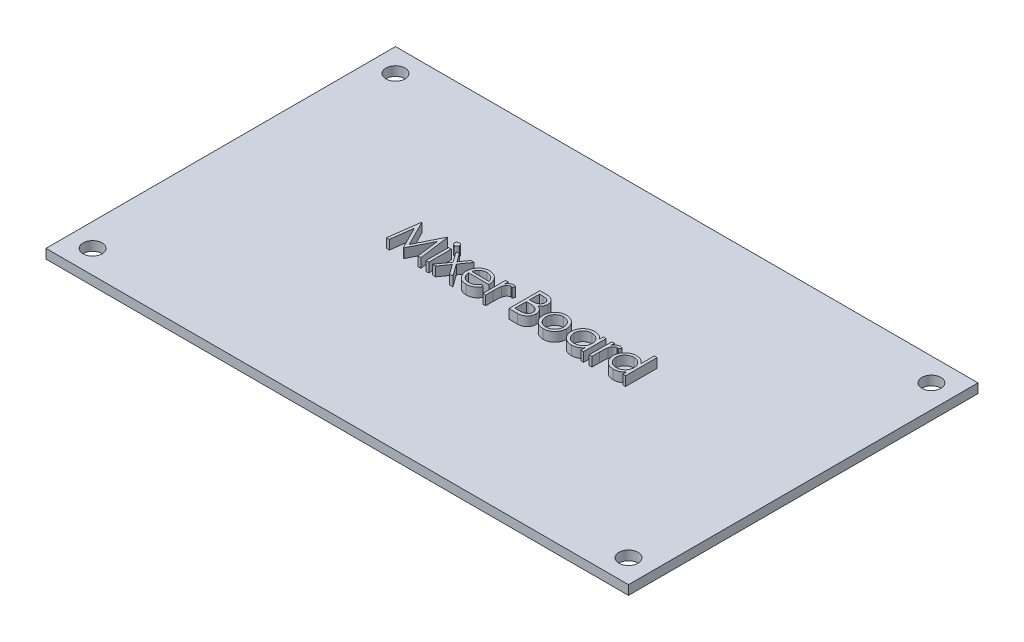
from build123d import *

# Parameters (mm, degrees)
SKETCH1_W             = 100
SKETCH1_H             = 60
BOSS_EXTRUDE1_DEPTH   = 1.6
F_4_CLEARANCE_HOLE1_D = 3.2639
SKETCH6_W             = 0.474893163
SKETCH6_H             = 3.86698718
BOSS_EXTRUDE2_DEPTH   = 1.6


with BuildPart() as part:
    # Sketch1 → Boss-Extrude1 (new body)
    with BuildSketch(Plane(origin=(0, 0, 0), x_dir=(1, 0, 0), z_dir=(0, 1, 0))):
        Rectangle(SKETCH1_W, SKETCH1_H)
    extrude(amount=BOSS_EXTRUDE1_DEPTH)

    # #4 Clearance Hole1 (through all)
    with Locations(Plane(origin=(0, 1.6, 0), x_dir=(1, 0, 0), z_dir=(0, 1, 0))):
        with Locations((-46, 26), (46, 26), (46, -26), (-46, -26)):
            Hole(F_4_CLEARANCE_HOLE1_D / 2)

    # Sketch6 → Boss-Extrude2 (add)
    # profile 1 of 11: a face of its own
    with BuildSketch(Plane(origin=(0, 1.6, 0), x_dir=(1, 0, 0), z_dir=(0, 1, 0))):
        Polygon((-20.754220467, -0.795536532), (-20.055661105, 4.496130135), (-19.987819225, 4.496130135), (-17.803098672, 0.154249793), (-15.623678266, 4.496130135), (-15.554776356, 4.496130135), (-14.851976877, -0.795536532), (-15.328990098, -0.795536532), (-15.835684142, 3.012089002), (-17.745857086, -0.795536532), (-17.852920053, -0.795536532), (-19.770513202, 3.020569237), (-20.276147216, -0.795536532), align=None)
    # profile 2 of 11: a face of its own
    with BuildSketch(Plane(origin=(0, 1.6, 0), x_dir=(1, 0, 0), z_dir=(0, 1, 0))):
        with BuildLine():
            add(Edge.make_bspline(
                [(-13.73470591, 4.699655776), (-13.705236897, 4.698288783), (-13.64753091, 4.69561195), (-13.564083945, 4.672689241), (-13.488100129, 4.633833764), (-13.420702843, 4.58170377), (-13.362869633, 4.520396873), (-13.32237975, 4.44894279), (-13.296356246, 4.371746991), (-13.293213668, 4.317900368), (-13.291613629, 4.290484435)],
                knots=[0, 0, 0, 0, 1.055194115, 2.066272739, 3.074728998, 4.095836921, 5.109056067, 6.073838105, 7.019297344, 8, 8, 8, 8], degree=3))
            add(Edge.make_bspline(
                [(-13.291613629, 4.290484435), (-13.293249752, 4.263780186), (-13.296484173, 4.210989045), (-13.322359649, 4.135131533), (-13.363214699, 4.064670295), (-13.420665758, 4.003482436), (-13.488109956, 3.95138126), (-13.564081335, 3.912518143), (-13.647531596, 3.889597459), (-13.705237129, 3.886920347), (-13.73470591, 3.885553212)],
                knots=[0, 0, 0, 0, 0.96129708, 1.900370562, 2.859976407, 3.87933698, 4.906634145, 5.921202961, 6.938410037, 8, 8, 8, 8], degree=3))
            add(Edge.make_bspline(
                [(-13.73470591, 3.885553212), (-13.763837707, 3.886868146), (-13.820538944, 3.889427493), (-13.902736432, 3.912967877), (-13.978072362, 3.951394559), (-14.045601094, 4.003141291), (-14.1018896, 4.065046077), (-14.142859687, 4.135088533), (-14.168675403, 4.210999993), (-14.171917877, 4.263783863), (-14.173558074, 4.290484435)],
                knots=[0, 0, 0, 0, 1.054934014, 2.053291228, 3.073705704, 4.106921865, 5.123545215, 6.088680038, 7.033164197, 8, 8, 8, 8], degree=3))
            add(Edge.make_bspline(
                [(-14.173558074, 4.290484435), (-14.171953812, 4.317896553), (-14.16880294, 4.371735682), (-14.142840336, 4.448986505), (-14.102230865, 4.520018062), (-14.045563822, 4.58204471), (-13.978082281, 4.633820546), (-13.902733869, 4.67223953), (-13.820539621, 4.695781912), (-13.763837937, 4.698340983), (-13.73470591, 4.699655776)],
                knots=[0, 0, 0, 0, 0.98631895, 1.937192651, 2.907499808, 3.917963147, 4.944918757, 5.95915025, 6.951458133, 8, 8, 8, 8], degree=3))
        make_face()
    # profile 3 of 11: a face of its own
    with BuildSketch(Plane(origin=(0, 1.6, 0), x_dir=(1, 0, 0), z_dir=(0, 1, 0))):
        with Locations((-13.732585852, 1.137957058)):
            Rectangle(SKETCH6_W, SKETCH6_H)
    # profile 4 of 11: a face of its own
    with BuildSketch(Plane(origin=(0, 1.6, 0), x_dir=(1, 0, 0), z_dir=(0, 1, 0))):
        Polygon((-12.681036706, 3.071450648), (-12.116041047, 3.071450648), (-11.120673458, 1.676451983), (-10.12530587, 3.071450648), (-9.560310211, 3.071450648), (-10.837645614, 1.281061024), (-9.35678457, -0.795536532), (-9.921780229, -0.795536532), (-11.120673458, 0.884610036), (-12.319566688, -0.795536532), (-12.884562347, -0.795536532), (-11.402641274, 1.281061024), align=None)
    # profile 5 of 11: a face of its own
    with BuildSketch(Plane(origin=(0, 1.6, 0), x_dir=(1, 0, 0), z_dir=(0, 1, 0))):
        with BuildLine():
            Line((-5.640321562, 0.425617314), (-5.218429869, 0.204071174))
            add(Edge.make_bspline(
                [(-5.218429869, 0.204071174), (-5.252049483, 0.144436613), (-5.317459939, 0.028411375), (-5.429946784, -0.130991557), (-5.54786337, -0.274392271), (-5.676532464, -0.397959724), (-5.812104479, -0.505685032), (-5.955331231, -0.599933886), (-6.106958372, -0.68024403), (-6.266993075, -0.74790559), (-6.436779301, -0.799929468), (-6.616728498, -0.836675136), (-6.807185402, -0.859388887), (-6.937732602, -0.862027374), (-7.004579375, -0.863378412)],
                knots=[0, 0, 0, 0, 1.120438281, 2.179929193, 3.190490725, 4.156257408, 5.095198341, 6.022838206, 6.959905092, 7.901321166, 8.864066838, 9.862729781, 10.905609505, 12, 12, 12, 12], degree=3))
            add(Edge.make_bspline(
                [(-7.004579375, -0.863378412), (-7.078877364, -0.861643992), (-7.223811218, -0.858260642), (-7.434782026, -0.829092273), (-7.633415195, -0.781509064), (-7.819699556, -0.715037352), (-7.993178914, -0.628212708), (-8.154198063, -0.522440634), (-8.303603775, -0.398264487), (-8.436687996, -0.254608674), (-8.5564972, -0.100875238), (-8.66221838, 0.059319968), (-8.750600448, 0.225573891), (-8.822495466, 0.396828136), (-8.880559964, 0.572003308), (-8.921028671, 0.752693265), (-8.944356981, 0.93840897), (-8.947931797, 1.064044227), (-8.949733287, 1.127356764)],
                knots=[0, 0, 0, 0, 1.145258523, 2.234067595, 3.276747158, 4.290159414, 5.277019952, 6.260822364, 7.254936242, 8.264827045, 9.274100331, 10.257902744, 11.220704747, 12.172965371, 13.118907548, 14.062713208, 15.023725156, 16, 16, 16, 16], degree=3))
            add(Edge.make_bspline(
                [(-8.949733287, 1.127356764), (-8.948131967, 1.186766805), (-8.94495836, 1.304509661), (-8.92495467, 1.478780187), (-8.889503084, 1.648156538), (-8.840855546, 1.812779453), (-8.778034019, 1.972373299), (-8.701180545, 2.127035204), (-8.610175403, 2.276600594), (-8.539913146, 2.370948189), (-8.504520948, 2.418472549)],
                knots=[0, 0, 0, 0, 1.024358464, 2.0301432, 3.019427413, 4.004406732, 4.986367066, 5.972626655, 6.978780325, 8, 8, 8, 8], degree=3))
            add(Edge.make_bspline(
                [(-8.504520948, 2.418472549), (-8.456581951, 2.475726674), (-8.362222544, 2.588421259), (-8.202631387, 2.73649468), (-8.029820376, 2.860537054), (-7.84595518, 2.963357367), (-7.648898844, 3.041483), (-7.441300273, 3.099702797), (-7.220795637, 3.132326695), (-7.070050839, 3.136934729), (-6.992919051, 3.139292528)],
                knots=[0, 0, 0, 0, 1.030682036, 2.02871468, 2.997146059, 3.962720338, 4.930598197, 5.918074684, 6.934738563, 8, 8, 8, 8], degree=3))
            add(Edge.make_bspline(
                [(-6.992919051, 3.139292528), (-6.913623267, 3.137245335), (-6.758063014, 3.133229209), (-6.531228736, 3.095996538), (-6.316597653, 3.036952795), (-6.114255652, 2.953565517), (-5.92418222, 2.845979051), (-5.747612835, 2.712716981), (-5.581527811, 2.557870588), (-5.484904126, 2.438788116), (-5.435735892, 2.378191433)],
                knots=[0, 0, 0, 0, 1.056321875, 2.072262726, 3.055038591, 4.01806755, 4.982017516, 5.957941055, 6.960871419, 8, 8, 8, 8], degree=3))
            add(Edge.make_bspline(
                [(-5.435735892, 2.378191433), (-5.402282068, 2.332526494), (-5.3355971, 2.241500577), (-5.252068746, 2.093075137), (-5.179561733, 1.9377865), (-5.121605946, 1.773124503), (-5.074677177, 1.601040138), (-5.040724606, 1.420303196), (-5.020813396, 1.230967496), (-5.016899533, 1.101961871), (-5.014904228, 1.036194237)],
                knots=[0, 0, 0, 0, 0.94817472, 1.890038105, 2.849395472, 3.817997239, 4.812318967, 5.836947057, 6.897266129, 8, 8, 8, 8], degree=3))
            Line((-5.014904228, 1.036194237), (-8.474840125, 1.036194237))
            add(Edge.make_bspline(
                [(-8.474840125, 1.036194237), (-8.472512387, 0.985242345), (-8.467934983, 0.885047504), (-8.446594231, 0.738436915), (-8.412956204, 0.598777219), (-8.365680359, 0.467115953), (-8.308429296, 0.341733498), (-8.23829851, 0.223559943), (-8.154630375, 0.113133548), (-8.061306996, 0.009466566), (-7.957428411, -0.082851489), (-7.848143781, -0.16547977), (-7.731888034, -0.23473347), (-7.609577837, -0.290945922), (-7.481410971, -0.3349519), (-7.347347057, -0.364990153), (-7.207649905, -0.385109231), (-7.112421474, -0.387346344), (-7.06394102, -0.38848525)],
                knots=[0, 0, 0, 0, 1.094153842, 2.151609401, 3.174256925, 4.172055639, 5.149267565, 6.128595816, 7.11444997, 8.118368179, 9.117203808, 10.09244225, 11.054858984, 12.015122123, 12.976791628, 13.957293641, 14.960065497, 16, 16, 16, 16], degree=3))
            add(Edge.make_bspline(
                [(-7.06394102, -0.38848525), (-7.016541071, -0.387565926), (-6.922490478, -0.385741811), (-6.782426325, -0.368004279), (-6.644632039, -0.339323029), (-6.509677934, -0.30017983), (-6.380302964, -0.252438637), (-6.26049124, -0.194830745), (-6.150303295, -0.131104342), (-6.047316929, -0.058215905), (-5.947423879, 0.030998854), (-5.848329882, 0.142329051), (-5.742078275, 0.273997099), (-5.6755702, 0.373095904), (-5.640321562, 0.425617314)],
                knots=[0, 0, 0, 0, 0.99110716, 1.966546729, 2.947904876, 3.932708344, 4.903319531, 5.828989031, 6.710028674, 7.56322171, 8.463672341, 9.504779593, 10.677557249, 12, 12, 12, 12], degree=3))
        make_face()
        with BuildLine():
            add(Edge.make_bspline(
                [(-5.48979739, 1.5110874), (-5.507179191, 1.574077697), (-5.540633564, 1.695313742), (-5.610538544, 1.863196993), (-5.689265754, 2.012403701), (-5.782431943, 2.141791956), (-5.887991207, 2.256702029), (-6.009919042, 2.357120604), (-6.1466495, 2.446954131), (-6.29747582, 2.522779934), (-6.457196138, 2.587322935), (-6.624422166, 2.630601383), (-6.795052393, 2.660249144), (-6.910462564, 2.663010046), (-6.968538376, 2.664399366)],
                knots=[0, 0, 0, 0, 1.154881502, 2.222775134, 3.210006277, 4.132804581, 5.035138423, 5.962687519, 6.919655026, 7.923214229, 8.944639381, 9.960483929, 10.97369054, 12, 12, 12, 12], degree=3))
            add(Edge.make_bspline(
                [(-6.968538376, 2.664399366), (-7.015935741, 2.663474576), (-7.109630368, 2.661646463), (-7.247668887, 2.64430472), (-7.380232242, 2.61563924), (-7.508298569, 2.576382698), (-7.630189644, 2.524057787), (-7.748412687, 2.462699814), (-7.859961619, 2.387797657), (-7.929722863, 2.330709865), (-7.964965993, 2.301869317)],
                knots=[0, 0, 0, 0, 1.04873581, 2.073130211, 3.073294108, 4.04793562, 5.032784715, 6.005352987, 6.992311501, 8, 8, 8, 8], degree=3))
            add(Edge.make_bspline(
                [(-7.964965993, 2.301869317), (-7.990204646, 2.27904815), (-8.041281527, 2.232863668), (-8.109529697, 2.15329332), (-8.174874935, 2.067490363), (-8.234343672, 1.972172139), (-8.288889547, 1.868424057), (-8.339931417, 1.757121203), (-8.385872778, 1.637418971), (-8.411720468, 1.554003497), (-8.425018744, 1.5110874)],
                knots=[0, 0, 0, 0, 0.879870761, 1.780643979, 2.707998968, 3.669668524, 4.684282772, 5.740141944, 6.837334558, 8, 8, 8, 8], degree=3))
            Line((-8.425018744, 1.5110874), (-5.48979739, 1.5110874))
        make_face(mode=Mode.SUBTRACT)
    # profile 6 of 11: a face of its own
    with BuildSketch(Plane(origin=(0, 1.6, 0), x_dir=(1, 0, 0), z_dir=(0, 1, 0))):
        with BuildLine():
            Line((-4.200801664, 3.071450648), (-3.725908501, 3.071450648))
            Line((-3.725908501, 3.071450648), (-3.725908501, 2.50221487))
            add(Edge.make_bspline(
                [(-3.725908501, 2.50221487), (-3.690849306, 2.555215944), (-3.623798869, 2.656580086), (-3.51235194, 2.790639624), (-3.398198094, 2.901636183), (-3.280790846, 2.990087931), (-3.159266814, 3.056329194), (-3.03629309, 3.104850807), (-2.909934939, 3.1335427), (-2.825023458, 3.137373351), (-2.782482353, 3.139292528)],
                knots=[0, 0, 0, 0, 1.2804753, 2.448899062, 3.506932113, 4.484331642, 5.4025378, 6.288909075, 7.142734305, 8, 8, 8, 8], degree=3))
            add(Edge.make_bspline(
                [(-2.782482353, 3.139292528), (-2.749483026, 3.137492565), (-2.681584766, 3.133789025), (-2.578801565, 3.107767897), (-2.472902536, 3.066223744), (-2.404651546, 3.027155788), (-2.369070894, 3.006788855)],
                knots=[0, 0, 0, 0, 0.901110191, 1.854092781, 2.881294221, 4, 4, 4, 4], degree=3))
            Line((-2.369070894, 3.006788855), (-2.629838122, 2.595497456))
            add(Edge.make_bspline(
                [(-2.629838122, 2.595497456), (-2.652681523, 2.605688096), (-2.696042671, 2.625031883), (-2.75947398, 2.64792516), (-2.817956477, 2.661405175), (-2.85521519, 2.663447332), (-2.87258485, 2.664399366)],
                knots=[0, 0, 0, 0, 1.180555205, 2.24091978, 3.179933427, 4, 4, 4, 4], degree=3))
            add(Edge.make_bspline(
                [(-2.87258485, 2.664399366), (-2.910693519, 2.661859309), (-2.988424156, 2.65667833), (-3.10254953, 2.615949418), (-3.213292329, 2.550143401), (-3.301242342, 2.477162077), (-3.369341939, 2.40678624), (-3.417934899, 2.345329727), (-3.462510004, 2.276419177), (-3.505100694, 2.201232631), (-3.543905687, 2.118486316), (-3.580122865, 2.029006934), (-3.612869003, 1.932690846), (-3.631541396, 1.865588703), (-3.641106151, 1.831216273)],
                knots=[0, 0, 0, 0, 1.125678352, 2.296057538, 3.5422874, 4.923748041, 5.663163013, 6.437101912, 7.23742474, 8.08941207, 8.991984279, 9.93940061, 10.944477711, 12, 12, 12, 12], degree=3))
            add(Edge.make_bspline(
                [(-3.641106151, 1.831216273), (-3.648261079, 1.800559117), (-3.664108701, 1.732655848), (-3.679517335, 1.618736055), (-3.694741488, 1.484140761), (-3.705470899, 1.328495317), (-3.715416272, 1.152188408), (-3.721025563, 0.954951442), (-3.725717216, 0.736581971), (-3.725842805, 0.583918365), (-3.725908501, 0.504059488)],
                knots=[0, 0, 0, 0, 0.566838948, 1.255505196, 2.06880316, 3.007127437, 4.065329342, 5.249902469, 6.561414163, 8, 8, 8, 8], degree=3))
            Line((-3.725908501, 0.504059488), (-3.725908501, -0.795536532))
            Line((-3.725908501, -0.795536532), (-4.200801664, -0.795536532))
            Line((-4.200801664, -0.795536532), (-4.200801664, 3.071450648))
        make_face()
    # profile 7 of 11: a face of its own
    with BuildSketch(Plane(origin=(0, 1.6, 0), x_dir=(1, 0, 0), z_dir=(0, 1, 0))):
        with BuildLine():
            Line((0.276762439, 4.496130135), (1.309231055, 4.496130135))
            add(Edge.make_bspline(
                [(1.309231055, 4.496130135), (1.359771731, 4.495864417), (1.457732138, 4.49534939), (1.600182961, 4.487361798), (1.733606758, 4.476470536), (1.858042223, 4.459189324), (1.973431857, 4.438337471), (2.080123403, 4.413085915), (2.177777592, 4.382807583), (2.294364706, 4.334659038), (2.427292372, 4.263110915), (2.571223275, 4.157385584), (2.694298732, 4.028068646), (2.800413759, 3.88219606), (2.884779738, 3.721728881), (2.945814271, 3.550491774), (2.984455344, 3.370693426), (2.988429286, 3.247256717), (2.990437653, 3.184873791)],
                knots=[0, 0, 0, 0, 1.001505555, 1.941167018, 2.826882275, 3.653841531, 4.429895133, 5.150066043, 5.825578002, 6.45369114, 7.647487171, 8.808567382, 9.977351308, 11.170798116, 12.373658725, 13.556498008, 14.765093433, 16, 16, 16, 16], degree=3))
            add(Edge.make_bspline(
                [(2.990437653, 3.184873791), (2.988784811, 3.126434808), (2.98553682, 3.011596696), (2.954478124, 2.843632983), (2.905854256, 2.683747211), (2.838264177, 2.532522891), (2.750419493, 2.393376833), (2.646312273, 2.265186561), (2.520708059, 2.153379606), (2.426602208, 2.090873075), (2.3788007, 2.059122589)],
                knots=[0, 0, 0, 0, 1.044552857, 2.05264487, 3.044412934, 4.028983338, 5.005914585, 5.980388656, 6.974128949, 8, 8, 8, 8], degree=3))
            add(Edge.make_bspline(
                [(2.3788007, 2.059122589), (2.43891468, 2.036043365), (2.553927615, 1.991887091), (2.712202895, 1.913819187), (2.848568911, 1.828907425), (2.96407412, 1.736179509), (3.062858432, 1.636229283), (3.149117046, 1.527591193), (3.222718647, 1.408848071), (3.285784615, 1.281237964), (3.334995234, 1.146063899), (3.37184928, 1.004593797), (3.392966733, 0.857334946), (3.395971857, 0.757117765), (3.397488935, 0.7065251)],
                knots=[0, 0, 0, 0, 1.27268992, 2.434971085, 3.483601985, 4.442670788, 5.356604649, 6.2567628, 7.179492994, 8.113709626, 9.066344395, 10.018646069, 10.999752585, 12, 12, 12, 12], degree=3))
            add(Edge.make_bspline(
                [(3.397488935, 0.7065251), (3.396012037, 0.654868043), (3.393106198, 0.553231337), (3.371667431, 0.403922979), (3.335367948, 0.261237048), (3.285367524, 0.124250641), (3.220110215, -0.006771229), (3.140692936, -0.131976998), (3.045999977, -0.250108664), (2.940071591, -0.362478904), (2.820234776, -0.463516154), (2.690943099, -0.553498234), (2.550568306, -0.627500018), (2.401415886, -0.689663527), (2.241812694, -0.73714822), (2.072475419, -0.770368659), (1.893550105, -0.792752465), (1.770768696, -0.794592763), (1.707802102, -0.795536532)],
                knots=[0, 0, 0, 0, 0.978564426, 1.925352924, 2.850884081, 3.763762016, 4.682927383, 5.618979971, 6.567305752, 7.547517671, 8.540179244, 9.531824382, 10.526200242, 11.540722885, 12.589160233, 13.674978461, 14.80764778, 16, 16, 16, 16], degree=3))
            Line((1.707802102, -0.795536532), (0.276762439, -0.795536532))
            Line((0.276762439, -0.795536532), (0.276762439, 4.496130135))
        make_face()
        with BuildLine():
            Line((0.751655601, 3.953395092), (0.751655601, 2.257348083))
            Line((0.751655601, 2.257348083), (1.070724445, 2.257348083))
            add(Edge.make_bspline(
                [(1.070724445, 2.257348083), (1.117364885, 2.257952729), (1.207483722, 2.259121027), (1.337991184, 2.262467654), (1.459132581, 2.271838506), (1.570698805, 2.281206664), (1.672514166, 2.296438481), (1.7643531, 2.314569429), (1.847656931, 2.333744773), (1.943722672, 2.366355783), (2.052690106, 2.414551792), (2.168854442, 2.489348497), (2.271262509, 2.578436507), (2.35773921, 2.681232366), (2.428513695, 2.794422909), (2.477671336, 2.916202121), (2.51100473, 3.043534939), (2.514015736, 3.130950631), (2.51554449, 3.175333527)],
                knots=[0, 0, 0, 0, 1.156816544, 2.235205308, 3.236616184, 4.169592532, 5.011045266, 5.787822928, 6.49130361, 7.128639758, 8.301311294, 9.436451833, 10.541879658, 11.654887649, 12.756523258, 13.837046038, 14.901820046, 16, 16, 16, 16], degree=3))
            add(Edge.make_bspline(
                [(2.51554449, 3.175333527), (2.514748956, 3.204703443), (2.513188429, 3.262315742), (2.50040784, 3.346301075), (2.478685436, 3.425288653), (2.450784302, 3.500360939), (2.411794261, 3.569170522), (2.365887596, 3.634096544), (2.310422326, 3.692927961), (2.247289246, 3.747915179), (2.174704781, 3.796665834), (2.092712232, 3.839363178), (2.000202292, 3.873745067), (1.898734047, 3.903856393), (1.786745617, 3.925005361), (1.665529328, 3.942624173), (1.534092312, 3.951593914), (1.443158646, 3.952781308), (1.396153465, 3.953395092)],
                knots=[0, 0, 0, 0, 0.91205012, 1.789085906, 2.630437955, 3.453916878, 4.269457761, 5.079663411, 5.91843418, 6.774407191, 7.675494373, 8.627863946, 9.638891023, 10.736472738, 11.911756761, 13.175263542, 14.539845004, 16, 16, 16, 16], degree=3))
            Line((1.396153465, 3.953395092), (0.751655601, 3.953395092))
        make_face(mode=Mode.SUBTRACT)
        with BuildLine():
            Line((0.751655601, 1.714613041), (0.751655601, -0.252801489))
            Line((0.751655601, -0.252801489), (1.427954346, -0.252801489))
            add(Edge.make_bspline(
                [(1.427954346, -0.252801489), (1.476363913, -0.2522213), (1.56966697, -0.251103061), (1.704379544, -0.247452484), (1.829237332, -0.239148687), (1.943670585, -0.226076985), (2.04891496, -0.211897663), (2.143707916, -0.192830608), (2.228817863, -0.170985155), (2.3275064, -0.137218014), (2.438636704, -0.084760254), (2.558395975, -0.005666126), (2.664873709, 0.088560779), (2.755293566, 0.197615852), (2.829396536, 0.316196549), (2.883304189, 0.441904399), (2.91655227, 0.57266228), (2.920577216, 0.661814333), (2.922595772, 0.7065251)],
                knots=[0, 0, 0, 0, 1.160039823, 2.235823828, 3.228722157, 4.157150951, 4.99529583, 5.772374946, 6.472645482, 7.099169577, 8.269452708, 9.405989375, 10.527446681, 11.663510218, 12.788923519, 13.866172445, 14.929861265, 16, 16, 16, 16], degree=3))
            add(Edge.make_bspline(
                [(2.922595772, 0.7065251), (2.922178329, 0.73448527), (2.921350175, 0.789954609), (2.908860912, 0.871470193), (2.890697085, 0.950430739), (2.867215037, 1.027050656), (2.833016557, 1.09994469), (2.793092375, 1.170554512), (2.746281685, 1.238973463), (2.673341101, 1.325472941), (2.567247743, 1.425133187), (2.416500595, 1.522707744), (2.245092477, 1.601399071), (2.120772339, 1.634811375), (2.056551769, 1.652071307)],
                knots=[0, 0, 0, 0, 0.723448775, 1.435228256, 2.130040452, 2.821711965, 3.505591119, 4.210454504, 4.921174351, 5.648778258, 7.137944449, 8.670945889, 10.280296675, 12, 12, 12, 12], degree=3))
            add(Edge.make_bspline(
                [(2.056551769, 1.652071307), (2.030805397, 1.657295065), (1.974981954, 1.66862125), (1.883953827, 1.680576944), (1.780031739, 1.691228404), (1.662975722, 1.699107178), (1.532637677, 1.707251119), (1.38873924, 1.710418289), (1.231868062, 1.714196932), (1.123022452, 1.71447079), (1.066484327, 1.714613041)],
                knots=[0, 0, 0, 0, 0.634451884, 1.375622551, 2.216452059, 3.157844607, 4.20941857, 5.370758133, 6.634282058, 8, 8, 8, 8], degree=3))
            Line((1.066484327, 1.714613041), (0.751655601, 1.714613041))
        make_face(mode=Mode.SUBTRACT)
    # profile 8 of 11: a face of its own
    with BuildSketch(Plane(origin=(0, 1.6, 0), x_dir=(1, 0, 0), z_dir=(0, 1, 0))):
        with BuildLine():
            add(Edge.make_bspline(
                [(6.215047028, 3.139292528), (6.287605262, 3.137747526), (6.429874226, 3.134718154), (6.638226625, 3.102340766), (6.837110342, 3.05282987), (7.027287085, 2.984383579), (7.206321246, 2.892638249), (7.376820627, 2.783162297), (7.538317772, 2.653467186), (7.635114494, 2.553140106), (7.684247749, 2.50221487)],
                knots=[0, 0, 0, 0, 1.054011418, 2.066658804, 3.057071809, 4.030435133, 4.997543892, 5.974964718, 6.972108034, 8, 8, 8, 8], degree=3))
            add(Edge.make_bspline(
                [(7.684247749, 2.50221487), (7.726553798, 2.453510392), (7.810347159, 2.357044001), (7.917791758, 2.200628967), (8.010352926, 2.038643338), (8.08453145, 1.868936071), (8.143019522, 1.692988651), (8.184545039, 1.510196325), (8.209244929, 1.320962776), (8.212575605, 1.192445069), (8.214262439, 1.127356764)],
                knots=[0, 0, 0, 0, 1.025258237, 2.030674902, 3.01204498, 3.988269485, 4.97094183, 5.956517959, 6.965070386, 8, 8, 8, 8], degree=3))
            add(Edge.make_bspline(
                [(8.214262439, 1.127356764), (8.21277875, 1.061891201), (8.209846913, 0.932528194), (8.182113112, 0.741998915), (8.138976827, 0.557251981), (8.077242976, 0.37906086), (7.998082502, 0.206880871), (7.901485867, 0.041464053), (7.786775208, -0.117515958), (7.656745356, -0.268709214), (7.513035971, -0.408055753), (7.357134176, -0.529504446), (7.192103672, -0.633556036), (7.015750031, -0.717370617), (6.829683712, -0.783455521), (6.633503382, -0.829871022), (6.427513812, -0.85793452), (6.286865513, -0.861538256), (6.215047028, -0.863378412)],
                knots=[0, 0, 0, 0, 0.998656419, 1.973391657, 2.932242238, 3.890759089, 4.846373663, 5.82037756, 6.809684879, 7.83454468, 8.860553229, 9.859544525, 10.845671541, 11.83227036, 12.833544569, 13.85385346, 14.904124723, 16, 16, 16, 16], degree=3))
            add(Edge.make_bspline(
                [(6.215047028, -0.863378412), (6.142876678, -0.86153208), (6.001527402, -0.857915945), (5.794810739, -0.829980053), (5.598278815, -0.783476913), (5.41196891, -0.717153441), (5.234857058, -0.633553357), (5.068870331, -0.529819017), (4.912841887, -0.408019735), (4.769102101, -0.268718973), (4.6390804, -0.117513444), (4.524367637, 0.0414634), (4.427771549, 0.206881041), (4.348610931, 0.379060815), (4.286877119, 0.557251993), (4.243740824, 0.741998912), (4.216007026, 0.932528195), (4.213075188, 1.061891201), (4.211591499, 1.127356764)],
                knots=[0, 0, 0, 0, 1.099876186, 2.154163076, 3.173186993, 4.173200201, 5.163417411, 6.152872554, 7.150605724, 8.17532212, 9.198891216, 10.186952605, 11.159729845, 12.11414092, 13.071450619, 14.029093627, 15.002601286, 16, 16, 16, 16], degree=3))
            add(Edge.make_bspline(
                [(4.211591499, 1.127356764), (4.213289837, 1.192091304), (4.216652255, 1.320254567), (4.24132731, 1.509132385), (4.282690842, 1.691615342), (4.341249025, 1.866883621), (4.416111278, 2.035847197), (4.507371797, 2.198233072), (4.615912396, 2.353940818), (4.699372489, 2.450282535), (4.741606189, 2.499034782)],
                knots=[0, 0, 0, 0, 1.031353054, 2.041901799, 3.029428768, 4.008703097, 4.981709435, 5.96992636, 6.972712378, 8, 8, 8, 8], degree=3))
            add(Edge.make_bspline(
                [(4.741606189, 2.499034782), (4.790665368, 2.550401655), (4.887148877, 2.651423648), (5.049449929, 2.780740678), (5.219529873, 2.892494742), (5.400542559, 2.982417116), (5.590563071, 3.053232494), (5.790465973, 3.102468451), (5.999525383, 3.1346015), (6.142490525, 3.137713268), (6.215047028, 3.139292528)],
                knots=[0, 0, 0, 0, 1.027980169, 2.021703884, 2.998553061, 3.971491411, 4.943284454, 5.930300938, 6.949603206, 8, 8, 8, 8], degree=3))
        make_face()
        with BuildLine():
            add(Edge.make_bspline(
                [(6.212926969, 2.664399366), (6.161616533, 2.662940995), (6.060320231, 2.660061901), (5.911216811, 2.638163616), (5.767676341, 2.603469176), (5.629426493, 2.554174948), (5.496933482, 2.490525422), (5.370070457, 2.412347306), (5.248464268, 2.32067605), (5.134493768, 2.215655106), (5.0298967, 2.100933293), (4.93845976, 1.978698274), (4.860709896, 1.850932727), (4.795939656, 1.717503789), (4.747699027, 1.577059306), (4.712663623, 1.43118978), (4.690785998, 1.27959802), (4.687933973, 1.176545051), (4.686484661, 1.124176676)],
                knots=[0, 0, 0, 0, 1.021534396, 2.016698045, 2.994645724, 3.958388632, 4.93408049, 5.916473867, 6.921342795, 7.962252576, 8.998418191, 10.008913653, 10.997312074, 11.973003931, 12.956656626, 13.948281152, 14.957379055, 16, 16, 16, 16], degree=3))
            add(Edge.make_bspline(
                [(4.686484661, 1.124176676), (4.688914026, 1.056515873), (4.693735859, 0.922221831), (4.732947467, 0.724447872), (4.79854339, 0.534580072), (4.887121777, 0.353731488), (4.998104989, 0.186405544), (5.128865197, 0.037223657), (5.277999029, -0.091569177), (5.443728738, -0.198431884), (5.622669195, -0.283340086), (5.812044823, -0.343512347), (6.009561111, -0.382627882), (6.144545073, -0.386515706), (6.212926969, -0.38848525)],
                knots=[0, 0, 0, 0, 1.016792936, 2.018143844, 3.017858371, 4.030088057, 5.03801393, 6.028138512, 7.003788237, 7.991172063, 8.984598303, 9.972568034, 10.972917682, 12, 12, 12, 12], degree=3))
            add(Edge.make_bspline(
                [(6.212926969, -0.38848525), (6.281304931, -0.386504231), (6.41628113, -0.382593754), (6.613522981, -0.343709348), (6.80238101, -0.283076433), (6.981135608, -0.198527377), (7.146789877, -0.091163369), (7.296996287, 0.036496391), (7.42664002, 0.186800666), (7.537513447, 0.353953121), (7.62754245, 0.534299701), (7.692831339, 0.724482915), (7.732137213, 0.922212907), (7.736946323, 1.056512883), (7.739369277, 1.124176676)],
                knots=[0, 0, 0, 0, 1.02726834, 2.027799167, 3.010890988, 4.004497153, 4.992059811, 5.971914811, 6.958719428, 7.966827853, 8.981595046, 9.981490638, 10.983022906, 12, 12, 12, 12], degree=3))
            add(Edge.make_bspline(
                [(7.739369277, 1.124176676), (7.737920464, 1.176545364), (7.735069421, 1.279598948), (7.713184653, 1.431186229), (7.678175683, 1.577072334), (7.629837642, 1.71745572), (7.565348835, 1.851278197), (7.486099636, 1.978323141), (7.395036062, 2.101356728), (7.289176844, 2.215284257), (7.175325308, 2.320716991), (7.053669834, 2.412382853), (6.926994926, 2.490181837), (6.79488683, 2.554719367), (6.656619258, 2.603020703), (6.513279908, 2.638363944), (6.36481266, 2.65996936), (6.263879344, 2.662913253), (6.212926969, 2.664399366)],
                knots=[0, 0, 0, 0, 1.042956736, 2.052379634, 3.044323526, 4.02829302, 5.004299113, 5.996692471, 7.007513377, 8.048758398, 9.090003419, 10.095195979, 11.07790575, 12.047570684, 13.018257071, 13.989683339, 14.985167495, 16, 16, 16, 16], degree=3))
        make_face(mode=Mode.SUBTRACT)
    # profile 9 of 11: a face of its own
    with BuildSketch(Plane(origin=(0, 1.6, 0), x_dir=(1, 0, 0), z_dir=(0, 1, 0))):
        with BuildLine():
            Line((13.098877824, 3.071450648), (13.098877824, -0.795536532))
            Line((13.098877824, -0.795536532), (12.623984661, -0.795536532))
            Line((12.623984661, -0.795536532), (12.623984661, -0.126657993))
            add(Edge.make_bspline(
                [(12.623984661, -0.126657993), (12.570434823, -0.187194046), (12.46593164, -0.305330914), (12.291395664, -0.459669437), (12.106386634, -0.587241423), (11.911802493, -0.690277605), (11.707818959, -0.767675119), (11.494888208, -0.822687526), (11.272923382, -0.858056777), (11.121351369, -0.861588619), (11.044540885, -0.863378412)],
                knots=[0, 0, 0, 0, 1.074387032, 2.096679803, 3.090159297, 4.057316773, 5.018401886, 5.985159533, 6.978961417, 8, 8, 8, 8], degree=3))
            add(Edge.make_bspline(
                [(11.044540885, -0.863378412), (10.97625124, -0.861524254), (10.841581037, -0.857867772), (10.643477552, -0.829500956), (10.452838079, -0.783946326), (10.269482475, -0.720596171), (10.094597208, -0.636563263), (9.926684919, -0.535959233), (9.766615492, -0.416154644), (9.61682876, -0.279194173), (9.478894664, -0.130430323), (9.357849645, 0.028237349), (9.256925346, 0.196122737), (9.1725307, 0.371100243), (9.107524322, 0.554516848), (9.062207042, 0.74573828), (9.033873271, 0.944538446), (9.030218301, 1.079913678), (9.028365003, 1.148557352)],
                knots=[0, 0, 0, 0, 1.033919861, 2.038935746, 3.024066025, 3.998881131, 4.97069526, 5.957263378, 6.95902576, 7.993208707, 9.027059324, 10.027763471, 11.009749337, 11.988697705, 12.965288445, 13.950418724, 14.960734635, 16, 16, 16, 16], degree=3))
            add(Edge.make_bspline(
                [(9.028365003, 1.148557352), (9.030259377, 1.215782237), (9.034004451, 1.348682208), (9.061903961, 1.544139287), (9.108819891, 1.732399039), (9.174660089, 1.91285537), (9.259087807, 2.085726636), (9.361788605, 2.251135102), (9.482769901, 2.409536453), (9.622246754, 2.557206046), (9.773338609, 2.693611022), (9.934974429, 2.812158032), (10.103133437, 2.914539458), (10.280423941, 2.995658404), (10.464221826, 3.061288836), (10.656163345, 3.106695823), (10.855449899, 3.133452488), (10.990751, 3.137327143), (11.059381296, 3.139292528)],
                knots=[0, 0, 0, 0, 1.020392517, 2.01726096, 2.990465484, 3.961182959, 4.928053699, 5.906110375, 6.912531644, 7.948652711, 8.985773172, 9.998621852, 10.987621588, 11.969261332, 12.953316658, 13.946091881, 14.958173133, 16, 16, 16, 16], degree=3))
            add(Edge.make_bspline(
                [(11.059381296, 3.139292528), (11.138302511, 3.137118785), (11.29306329, 3.132856176), (11.51943778, 3.097382767), (11.733590741, 3.03745318), (11.937175297, 2.955935058), (12.129460382, 2.847609003), (12.308625608, 2.71096311), (12.476546041, 2.546859172), (12.573882911, 2.420811), (12.623984661, 2.355930816)],
                knots=[0, 0, 0, 0, 1.038897134, 2.037228247, 3.008116434, 3.962042015, 4.918381754, 5.904844433, 6.921570401, 8, 8, 8, 8], degree=3))
            Line((12.623984661, 2.355930816), (12.623984661, 3.071450648))
            Line((12.623984661, 3.071450648), (13.098877824, 3.071450648))
        make_face()
        with BuildLine():
            add(Edge.make_bspline(
                [(11.065741472, 2.664399366), (10.996323366, 2.661929461), (10.859303066, 2.657054262), (10.658153206, 2.618994335), (10.465667449, 2.555668817), (10.282808503, 2.469064038), (10.11246489, 2.360163448), (9.96022565, 2.228444214), (9.824845613, 2.077500157), (9.71098669, 1.908012442), (9.618170105, 1.726314614), (9.552905664, 1.536382428), (9.509862873, 1.341641569), (9.505465467, 1.209557508), (9.503258166, 1.143257205)],
                knots=[0, 0, 0, 0, 1.031046209, 2.035121221, 3.029706178, 4.034933723, 5.034054252, 6.02443088, 7.017295772, 8.038157696, 9.050218397, 10.03989886, 11.016116709, 12, 12, 12, 12], degree=3))
            add(Edge.make_bspline(
                [(9.503258166, 1.143257205), (9.506077707, 1.077353114), (9.511705737, 0.945803255), (9.552150239, 0.750796906), (9.620004334, 0.560819962), (9.7125965, 0.377484888), (9.828539373, 0.207268451), (9.96293055, 0.053447075), (10.117069666, -0.07882885), (10.287805302, -0.189557086), (10.470153066, -0.279005183), (10.661913891, -0.34124371), (10.859483011, -0.381426783), (10.993819278, -0.386120456), (11.061501355, -0.38848525)],
                knots=[0, 0, 0, 0, 0.979072187, 1.954306742, 2.945804271, 3.96968567, 4.997920485, 5.998718438, 6.996577872, 8.005894225, 9.015743152, 10.005417472, 10.995077863, 12, 12, 12, 12], degree=3))
            add(Edge.make_bspline(
                [(11.061501355, -0.38848525), (11.130212139, -0.385975543), (11.266871073, -0.380983983), (11.468617691, -0.342761118), (11.664401742, -0.279610673), (11.851556242, -0.192072708), (12.02590325, -0.083582419), (12.182382184, 0.043428301), (12.314697993, 0.191146211), (12.426870153, 0.353489182), (12.514825842, 0.531458509), (12.578894408, 0.720951869), (12.616773527, 0.921975858), (12.621547714, 1.059353461), (12.623984661, 1.129476823)],
                knots=[0, 0, 0, 0, 1.01762866, 2.023962475, 3.030623092, 4.058876274, 5.077231937, 6.066672613, 7.034107872, 8.005628644, 8.981990164, 9.965428785, 10.961468474, 12, 12, 12, 12], degree=3))
            add(Edge.make_bspline(
                [(12.623984661, 1.129476823), (12.622533752, 1.182904257), (12.619677904, 1.288066355), (12.597860257, 1.442473435), (12.563154595, 1.590237521), (12.514250266, 1.731513968), (12.450007491, 1.865521669), (12.37252575, 1.993222831), (12.28044251, 2.113953281), (12.175240101, 2.226050543), (12.060085568, 2.328295314), (11.938234298, 2.419560297), (11.808242622, 2.494533798), (11.672296625, 2.556584292), (11.530160441, 2.605961816), (11.38067748, 2.638902734), (11.225436631, 2.661521315), (11.119533666, 2.663429914), (11.065741472, 2.664399366)],
                knots=[0, 0, 0, 0, 1.050140795, 2.067009409, 3.05949893, 4.030605086, 5.00011959, 5.97591094, 6.962425594, 7.979863591, 8.993523472, 9.986985069, 10.967611495, 11.937549037, 12.921786183, 13.919465291, 14.943216303, 16, 16, 16, 16], degree=3))
        make_face(mode=Mode.SUBTRACT)
    # profile 10 of 11: a face of its own
    with BuildSketch(Plane(origin=(0, 1.6, 0), x_dir=(1, 0, 0), z_dir=(0, 1, 0))):
        with BuildLine():
            Line((14.048664148, 3.071450648), (14.523557311, 3.071450648))
            Line((14.523557311, 3.071450648), (14.523557311, 2.50221487))
            add(Edge.make_bspline(
                [(14.523557311, 2.50221487), (14.558616506, 2.555215944), (14.625666943, 2.656580086), (14.737113872, 2.790639624), (14.851267718, 2.901636183), (14.968674966, 2.990087931), (15.090198998, 3.056329194), (15.213172722, 3.104850807), (15.339530873, 3.1335427), (15.424442354, 3.137373351), (15.466983459, 3.139292528)],
                knots=[0, 0, 0, 0, 1.2804753, 2.448899062, 3.506932113, 4.484331642, 5.4025378, 6.288909075, 7.142734305, 8, 8, 8, 8], degree=3))
            add(Edge.make_bspline(
                [(15.466983459, 3.139292528), (15.499982786, 3.137492565), (15.567881046, 3.133789025), (15.670664247, 3.107767897), (15.776563276, 3.066223744), (15.844814266, 3.027155788), (15.880394918, 3.006788855)],
                knots=[0, 0, 0, 0, 0.901110191, 1.854092781, 2.881294221, 4, 4, 4, 4], degree=3))
            Line((15.880394918, 3.006788855), (15.61962769, 2.595497456))
            add(Edge.make_bspline(
                [(15.61962769, 2.595497456), (15.596784289, 2.605688096), (15.553423141, 2.625031883), (15.489991832, 2.64792516), (15.431509335, 2.661405175), (15.394250622, 2.663447332), (15.376880962, 2.664399366)],
                knots=[0, 0, 0, 0, 1.180555205, 2.24091978, 3.179933427, 4, 4, 4, 4], degree=3))
            add(Edge.make_bspline(
                [(15.376880962, 2.664399366), (15.338772293, 2.661859309), (15.261041656, 2.65667833), (15.146916282, 2.615949418), (15.036173483, 2.550143401), (14.94822347, 2.477162077), (14.880123873, 2.40678624), (14.831530913, 2.345329727), (14.786955808, 2.276419177), (14.744365118, 2.201232631), (14.705560125, 2.118486316), (14.669342947, 2.029006934), (14.636596809, 1.932690846), (14.617924416, 1.865588703), (14.608359661, 1.831216273)],
                knots=[0, 0, 0, 0, 1.125678352, 2.296057538, 3.5422874, 4.923748041, 5.663163013, 6.437101912, 7.23742474, 8.08941207, 8.991984279, 9.93940061, 10.944477711, 12, 12, 12, 12], degree=3))
            add(Edge.make_bspline(
                [(14.608359661, 1.831216273), (14.601204733, 1.800559117), (14.585357111, 1.732655848), (14.569948477, 1.618736055), (14.554724324, 1.484140761), (14.543994913, 1.328495317), (14.53404954, 1.152188408), (14.528440249, 0.954951442), (14.523748596, 0.736581971), (14.523623007, 0.583918365), (14.523557311, 0.504059488)],
                knots=[0, 0, 0, 0, 0.566838948, 1.255505196, 2.06880316, 3.007127437, 4.065329342, 5.249902469, 6.561414163, 8, 8, 8, 8], degree=3))
            Line((14.523557311, 0.504059488), (14.523557311, -0.795536532))
            Line((14.523557311, -0.795536532), (14.048664148, -0.795536532))
            Line((14.048664148, -0.795536532), (14.048664148, 3.071450648))
        make_face()
    # profile 11 of 11: a face of its own
    with BuildSketch(Plane(origin=(0, 1.6, 0), x_dir=(1, 0, 0), z_dir=(0, 1, 0))):
        with BuildLine():
            Line((20.29011714, 4.631813895), (20.29011714, -0.795536532))
            Line((20.29011714, -0.795536532), (19.815223977, -0.795536532))
            Line((19.815223977, -0.795536532), (19.815223977, -0.126657993))
            add(Edge.make_bspline(
                [(19.815223977, -0.126657993), (19.761674139, -0.187194046), (19.657170957, -0.305330914), (19.482634981, -0.459669437), (19.29762595, -0.587241423), (19.103041809, -0.690277605), (18.899058275, -0.767675119), (18.686127524, -0.822687526), (18.464162698, -0.858056777), (18.312590685, -0.861588619), (18.235780201, -0.863378412)],
                knots=[0, 0, 0, 0, 1.074387032, 2.096679803, 3.090159297, 4.057316773, 5.018401886, 5.985159533, 6.978961417, 8, 8, 8, 8], degree=3))
            add(Edge.make_bspline(
                [(18.235780201, -0.863378412), (18.167490556, -0.861524254), (18.032820354, -0.857867772), (17.834716868, -0.829500956), (17.644077396, -0.783946326), (17.460721792, -0.720596171), (17.285836524, -0.636563263), (17.117924235, -0.535959233), (16.957854808, -0.416154644), (16.808068076, -0.279194173), (16.670133981, -0.130430323), (16.549088961, 0.028237349), (16.448164662, 0.196122737), (16.363770016, 0.371100243), (16.298763638, 0.554516848), (16.253446358, 0.74573828), (16.225112587, 0.944538446), (16.221457617, 1.079913678), (16.219604319, 1.148557352)],
                knots=[0, 0, 0, 0, 1.033919861, 2.038935746, 3.024066025, 3.998881131, 4.97069526, 5.957263378, 6.95902576, 7.993208707, 9.027059324, 10.027763471, 11.009749337, 11.988697705, 12.965288445, 13.950418724, 14.960734635, 16, 16, 16, 16], degree=3))
            add(Edge.make_bspline(
                [(16.219604319, 1.148557352), (16.221498693, 1.215782237), (16.225243767, 1.348682208), (16.253143278, 1.544139287), (16.300059207, 1.732399039), (16.365899406, 1.91285537), (16.450327123, 2.085726636), (16.553027922, 2.251135102), (16.674009217, 2.409536453), (16.813486071, 2.557206046), (16.964577926, 2.693611022), (17.126213745, 2.812158032), (17.294372754, 2.914539458), (17.471663258, 2.995658404), (17.655461142, 3.061288836), (17.847402661, 3.106695823), (18.046689215, 3.133452488), (18.181990316, 3.137327143), (18.250620612, 3.139292528)],
                knots=[0, 0, 0, 0, 1.020392517, 2.01726096, 2.990465484, 3.961182959, 4.928053699, 5.906110375, 6.912531644, 7.948652711, 8.985773172, 9.998621852, 10.987621588, 11.969261332, 12.953316658, 13.946091881, 14.958173133, 16, 16, 16, 16], degree=3))
            add(Edge.make_bspline(
                [(18.250620612, 3.139292528), (18.329567452, 3.136923228), (18.484531326, 3.132272555), (18.711163615, 3.093406977), (18.925532978, 3.028148816), (19.128873567, 2.938808427), (19.319973128, 2.822693005), (19.500232453, 2.682461649), (19.666516763, 2.514145607), (19.764899161, 2.387732871), (19.815223977, 2.323069905)],
                knots=[0, 0, 0, 0, 1.031072012, 2.023879775, 2.993683497, 3.952812103, 4.918022106, 5.908088563, 6.929940113, 8, 8, 8, 8], degree=3))
            Line((19.815223977, 2.323069905), (19.815223977, 4.631813895))
            Line((19.815223977, 4.631813895), (20.29011714, 4.631813895))
        make_face()
        with BuildLine():
            add(Edge.make_bspline(
                [(18.256980788, 2.664399366), (18.187562682, 2.661929461), (18.050542382, 2.657054262), (17.849392522, 2.618994335), (17.656906765, 2.555668817), (17.474047819, 2.469064038), (17.303704206, 2.360163448), (17.151464966, 2.228444214), (17.016084929, 2.077500157), (16.902226006, 1.908012442), (16.809409421, 1.726314614), (16.74414498, 1.536382428), (16.701102189, 1.341641569), (16.696704783, 1.209557508), (16.694497482, 1.143257205)],
                knots=[0, 0, 0, 0, 1.031046209, 2.035121221, 3.029706178, 4.034933723, 5.034054252, 6.02443088, 7.017295772, 8.038157696, 9.050218397, 10.03989886, 11.016116709, 12, 12, 12, 12], degree=3))
            add(Edge.make_bspline(
                [(16.694497482, 1.143257205), (16.697317023, 1.077353114), (16.702945053, 0.945803255), (16.743389556, 0.750796906), (16.81124365, 0.560819962), (16.903835816, 0.377484888), (17.019778689, 0.207268451), (17.154169866, 0.053447075), (17.308308982, -0.07882885), (17.479044618, -0.189557086), (17.661392383, -0.279005183), (17.853153208, -0.34124371), (18.050722327, -0.381426783), (18.185058594, -0.386120456), (18.252740671, -0.38848525)],
                knots=[0, 0, 0, 0, 0.979072187, 1.954306742, 2.945804271, 3.96968567, 4.997920485, 5.998718438, 6.996577872, 8.005894225, 9.015743152, 10.005417472, 10.995077863, 12, 12, 12, 12], degree=3))
            add(Edge.make_bspline(
                [(18.252740671, -0.38848525), (18.321451455, -0.385975543), (18.458110389, -0.380983983), (18.659857007, -0.342761118), (18.855641058, -0.279610673), (19.042795558, -0.192072708), (19.217142566, -0.083582419), (19.3736215, 0.043428301), (19.505937309, 0.191146211), (19.618109469, 0.353489182), (19.706065158, 0.531458509), (19.770133724, 0.720951869), (19.808012844, 0.921975858), (19.81278703, 1.059353461), (19.815223977, 1.129476823)],
                knots=[0, 0, 0, 0, 1.01762866, 2.023962475, 3.030623092, 4.058876274, 5.077231937, 6.066672613, 7.034107872, 8.005628644, 8.981990164, 9.965428785, 10.961468474, 12, 12, 12, 12], degree=3))
            add(Edge.make_bspline(
                [(19.815223977, 1.129476823), (19.813773068, 1.182904257), (19.81091722, 1.288066355), (19.789099573, 1.442473435), (19.754393911, 1.590237521), (19.705489582, 1.731513968), (19.641246807, 1.865521669), (19.563765066, 1.993222831), (19.471681826, 2.113953281), (19.366479417, 2.226050543), (19.251324884, 2.328295314), (19.129473615, 2.419560297), (18.999481938, 2.494533798), (18.863535941, 2.556584292), (18.721399757, 2.605961816), (18.571916796, 2.638902734), (18.416675947, 2.661521315), (18.310772982, 2.663429914), (18.256980788, 2.664399366)],
                knots=[0, 0, 0, 0, 1.050140795, 2.067009409, 3.05949893, 4.030605086, 5.00011959, 5.97591094, 6.962425594, 7.979863591, 8.993523472, 9.986985069, 10.967611495, 11.937549037, 12.921786183, 13.919465291, 14.943216303, 16, 16, 16, 16], degree=3))
        make_face(mode=Mode.SUBTRACT)
    extrude(amount=BOSS_EXTRUDE2_DEPTH)


solid = part.part
